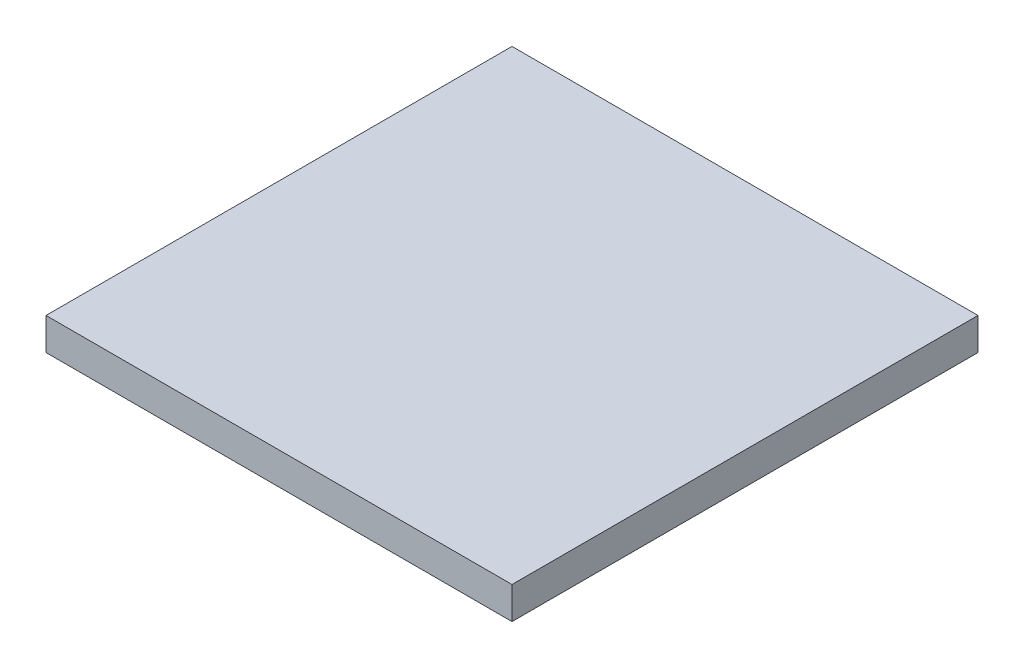
from build123d import *

# Parameters (mm, degrees)
SKETCH_1_W      = 58
SKETCH_1_H      = 58
EXTRUDE_1_DEPTH = 4


with BuildPart() as part:
    # 草图1 → 凸台-拉伸1 (new body)
    with BuildSketch(Plane(origin=(0, 0, 0), x_dir=(1, 0, 0), z_dir=(0, 1, 0))):
        Rectangle(SKETCH_1_W, SKETCH_1_H)
    extrude(amount=EXTRUDE_1_DEPTH)


solid = part.part
